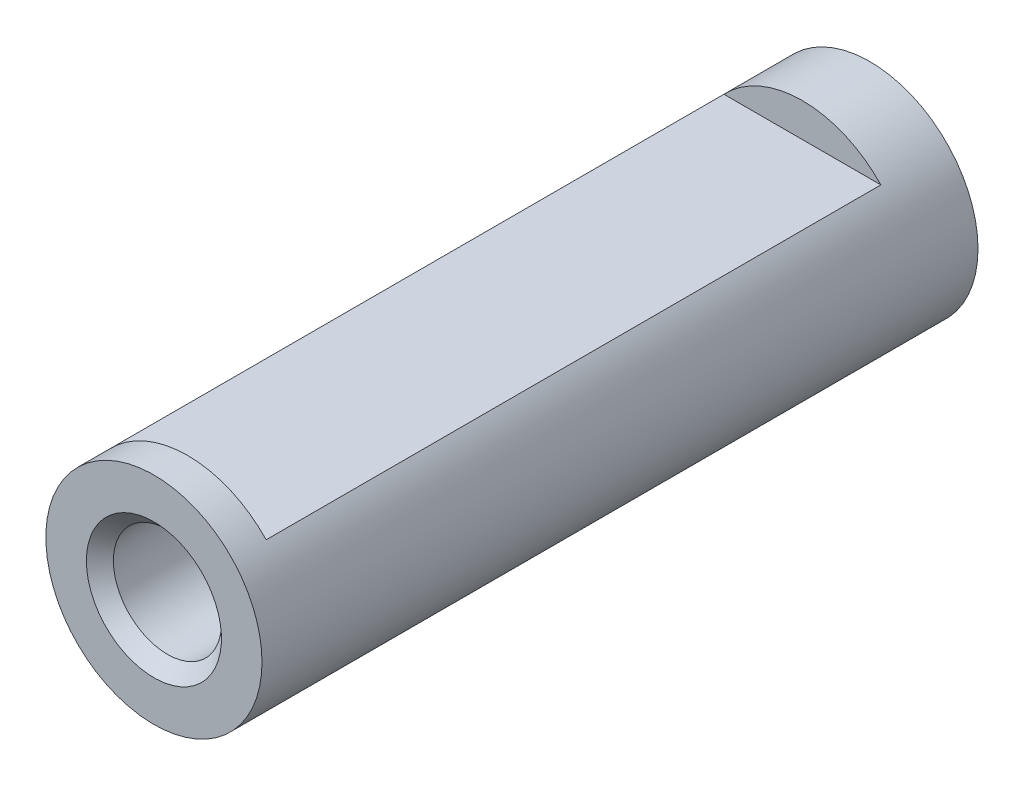
from build123d import *

# Parameters (mm, degrees)
CROQUIS1_W                 = 53
CROQUIS1_H                 = 4
CHAFL_N1_SIZE              = 1
CORTAR_EXTRUIR1_DEPTH      = 29.814059068
CORTAR_EXTRUIR1_DEPTH_BACK = 29.814059068
CROQUIS2_W                 = 45.5
CROQUIS2_H                 = 2.5


with BuildPart() as part:
    # Croquis1 → Revolución1 (revolve)
    with BuildSketch(Plane(origin=(0, 0, 0), x_dir=(0, 0, -1), z_dir=(1, 0, 0)), mode=Mode.PRIVATE) as revoluci_n1_sk:
        with Locations((0, 6)):
            Rectangle(CROQUIS1_W, CROQUIS1_H)
    revolve(revoluci_n1_sk.sketch.rotate(Axis((0, 0, 35.899159664), (0, 0, -1)), 90), axis=Axis((0, 0, 35.899159664), (0, 0, -1)))

    # Chaflán1
    chafl_n1_edges = [part.edges().sort_by_distance(p)[0] for p in [
        (-4, 0, 26.5),
    ]]
    chamfer(chafl_n1_edges, length=CHAFL_N1_SIZE)

    # Croquis2 → Cortar-Extruir1 (cut, two sides: drawn at the far end of the back side and taken through both)
    with BuildSketch(Plane(origin=(0, 0, 0), x_dir=(0, 0, -1), z_dir=(1, 0, 0)).offset(-CORTAR_EXTRUIR1_DEPTH_BACK)):
        with Locations((-1.25, 6.75)):
            Rectangle(CROQUIS2_W, CROQUIS2_H)
    extrude(amount=CORTAR_EXTRUIR1_DEPTH + CORTAR_EXTRUIR1_DEPTH_BACK, mode=Mode.SUBTRACT)


solid = part.part
